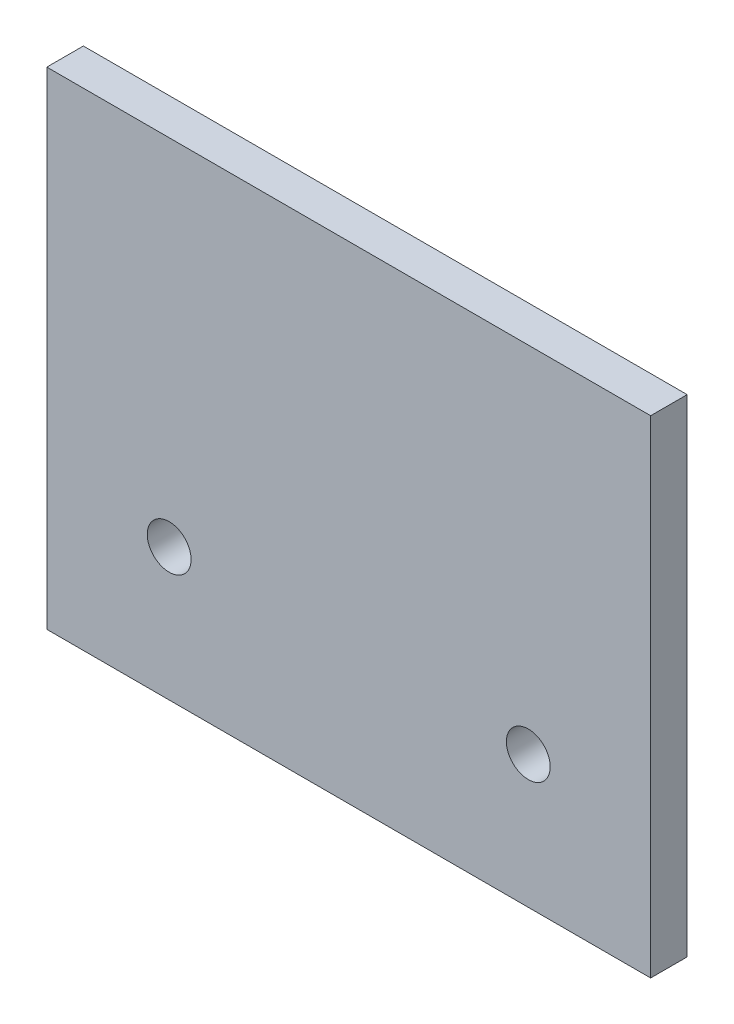
from build123d import *

# Parameters (mm, degrees)
SKETCH1_W           = 49.6
SKETCH1_H           = 40
SKETCH1_R           = 1.8
BOSS_EXTRUDE1_DEPTH = 3


with BuildPart() as part:
    # Sketch1 → Boss-Extrude1 (new body)
    with BuildSketch(Plane.XY):
        with Locations((-43.012787822, 28.211435671)):
            Rectangle(SKETCH1_W, SKETCH1_H)
        with Locations((-28.262787822, 19.101262419)):
            Circle(SKETCH1_R, mode=Mode.SUBTRACT)
        with Locations((-57.762787822, 19.101262419)):
            Circle(SKETCH1_R, mode=Mode.SUBTRACT)
    extrude(amount=BOSS_EXTRUDE1_DEPTH)


solid = part.part
